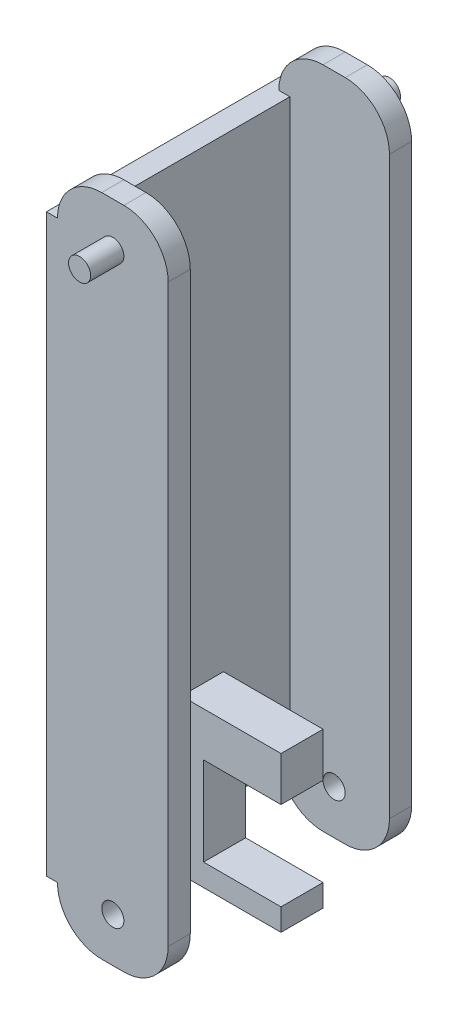
from build123d import *

# Parameters (mm, degrees)
SKETCH1_R           = 5
BOSS_EXTRUDE1_DEPTH = 10
SKETCH2_R           = 5
BOSS_EXTRUDE2_DEPTH = 15
SKETCH3_W           = 5
SKETCH3_H           = 260
BOSS_EXTRUDE3_DEPTH = 45
SKETCH8_W           = 5
SKETCH8_H           = 19
BOSS_EXTRUDE4_DEPTH = 20
SKETCH9_W           = 19
SKETCH9_H           = 10
SKETCH9_H_2         = 20
BOSS_EXTRUDE5_DEPTH = 45
SKETCH10_W          = 19
SKETCH10_H          = 40
BOSS_EXTRUDE6_DEPTH = 10
BOSS_EXTRUDE7_DEPTH = 5


with BuildPart() as part:
    # Sketch1 → Boss-Extrude1 (new body)
    with BuildSketch(Plane.XY):
        with BuildLine():
            Line((-5, -20), (5, -20))
            ThreePointArc((5, -20), (19.142135624, -14.142135624), (25, 0))
            Line((25, 0), (25, 260))
            ThreePointArc((25, 260), (19.142135624, 274.142135624), (5, 280))
            Line((5, 280), (-5, 280))
            ThreePointArc((-5, 280), (-19.142135624, 274.142135624), (-25, 260))
            Line((-25, 260), (-25, 0))
            ThreePointArc((-25, 0), (-19.142135624, -14.142135624), (-5, -20))
        make_face()
        Circle(SKETCH1_R, mode=Mode.SUBTRACT)
    boss_extrude1 = extrude(amount=BOSS_EXTRUDE1_DEPTH)

    # Sketch2 → Boss-Extrude2 (add)
    with BuildSketch(Plane.XY.offset(10)):
        with Locations((0, 260)):
            Circle(SKETCH2_R)
    boss_extrude2 = extrude(amount=BOSS_EXTRUDE2_DEPTH)

    # Sketch3 → Boss-Extrude3 (add)
    with BuildSketch(Plane(origin=(0, 0, 0), x_dir=(-1, 0, 0), z_dir=(0, 0, -1))):
        with Locations((22.5, 130)):
            Rectangle(SKETCH3_W, SKETCH3_H)
    boss_extrude3 = extrude(amount=BOSS_EXTRUDE3_DEPTH)

    # Mirror1: Boss-Extrude1, Boss-Extrude2, Boss-Extrude3 across plane
    add(boss_extrude1.mirror(Plane.XY.offset(-45)))
    add(boss_extrude2.mirror(Plane.XY.offset(-45)))
    add(boss_extrude3.mirror(Plane.XY.offset(-45)))

    # Sketch8 → Boss-Extrude4 (add)
    with BuildSketch(Plane.XZ):
        with Locations((-22.5, -50.5)):
            Rectangle(SKETCH8_W, SKETCH8_H)
    extrude(amount=BOSS_EXTRUDE4_DEPTH)

    # Sketch9 → Boss-Extrude5 (add)
    with BuildSketch(Plane(origin=(-20, 0, 0), x_dir=(0, 0, -1), z_dir=(1, 0, 0))):
        with Locations((50.5, -15)):
            Rectangle(SKETCH9_W, SKETCH9_H)
        with Locations((50.5, 40)):
            Rectangle(SKETCH9_W, SKETCH9_H_2)
    extrude(amount=BOSS_EXTRUDE5_DEPTH)

    # Sketch10 → Boss-Extrude6 (add)
    with BuildSketch(Plane(origin=(-20, 0, 0), x_dir=(0, 0, -1), z_dir=(1, 0, 0))):
        with Locations((50.5, 10)):
            Rectangle(SKETCH10_W, SKETCH10_H)
    extrude(amount=BOSS_EXTRUDE6_DEPTH)

    # Sketch11 → Boss-Extrude7 (add)
    with BuildSketch(Plane.ZY.offset(25)):
        Polygon((10, 0), (-41, 0), (-41, -20), (-60, -20), (-60, 0), (-100, 0), (-100, 260), (10, 260), align=None)
    extrude(amount=BOSS_EXTRUDE7_DEPTH)


solid = part.part
